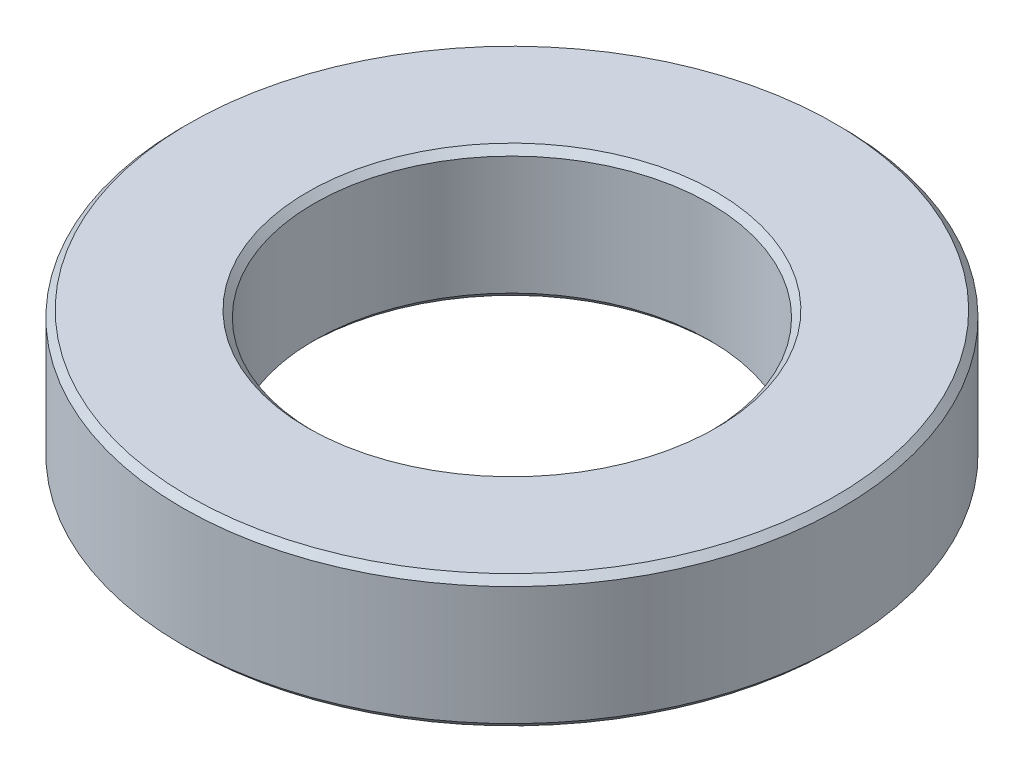
from build123d import *

# Parameters (mm, degrees)
SKETCH_1_R      = 5
SKETCH_1_R_2    = 3
EXTRUDE_1_DEPTH = 2
CHAMFER_1_SIZE  = 0.1


with BuildPart() as part:
    # 草图1 → 凸台-拉伸1 (new body)
    with BuildSketch(Plane(origin=(0, 0, 0), x_dir=(1, 0, 0), z_dir=(0, 1, 0))):
        with Locations(Location((0, 0, 0), (0, 0, 270))):
            Circle(SKETCH_1_R)
        with Locations(Location((0, 0, 0), (0, 0, 270))):
            Circle(SKETCH_1_R_2, mode=Mode.SUBTRACT)
    extrude(amount=EXTRUDE_1_DEPTH)

    # 倒角1
    chamfer_1_edges = [part.edges().sort_by_distance(p)[0] for p in [
        (0, 0, -5),
        (0, 2, -5),
        (0, 0, -3),
        (0, 2, -3),
    ]]
    chamfer(chamfer_1_edges, length=CHAMFER_1_SIZE)


solid = part.part
